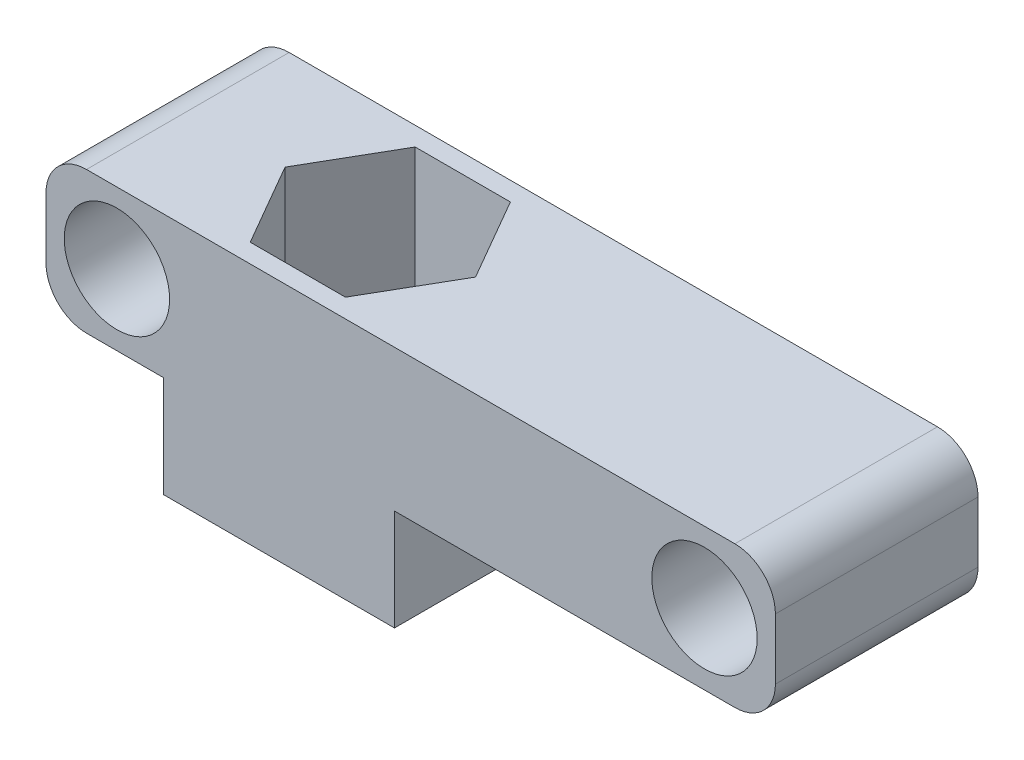
from build123d import *

# Parameters (mm, degrees)
CROQUIS1_W              = 36
CROQUIS1_H              = 7
CROQUIS1_R              = 2.6
SALIENTE_EXTRUIR1_DEPTH = 10
CORTAR_EXTRUIR1_DEPTH   = 7
CROQUIS4_W              = 11.4
CROQUIS4_H              = 10
SALIENTE_EXTRUIR2_DEPTH = 5
REDONDEO1_R             = 2


with BuildPart() as part:
    # Croquis1 → Saliente-Extruir1 (new body)
    with BuildSketch(Plane.XY):
        with Locations((-28.016694491, 12.37804878)):
            Rectangle(CROQUIS1_W, CROQUIS1_H)
        with Locations((-42.516694491, 12.37804878)):
            Circle(CROQUIS1_R, mode=Mode.SUBTRACT)
        with Locations((-13.516694491, 12.37804878)):
            Circle(CROQUIS1_R, mode=Mode.SUBTRACT)
    extrude(amount=SALIENTE_EXTRUIR1_DEPTH)

    # Croquis2 → Cortar-Extruir1 (cut)
    with BuildSketch(Plane.XZ.offset(-8.87804878)):
        Polygon((-29.816694491, 5), (-32.166694491, 9.070319398), (-36.866694491, 9.070319398), (-39.216694491, 5), (-36.866694491, 0.929680602), (-32.166694491, 0.929680602), align=None)
    extrude(amount=-CORTAR_EXTRUIR1_DEPTH, mode=Mode.SUBTRACT)

    # Croquis4 → Saliente-Extruir2 (add)
    with BuildSketch(Plane.XZ.offset(-8.87804878)):
        with Locations((-34.516694491, 5)):
            Rectangle(CROQUIS4_W, CROQUIS4_H)
        Polygon((-29.816694491, 5), (-32.166694491, 9.070319398), (-36.866694491, 9.070319398), (-39.216694491, 5), (-36.866694491, 0.929680602), (-32.166694491, 0.929680602), align=None, mode=Mode.SUBTRACT)
    extrude(amount=SALIENTE_EXTRUIR2_DEPTH)

    # Redondeo1
    redondeo1_edges = [part.edges().sort_by_distance(p)[0] for p in [
        (-10.016694491, 15.87804878, 5),
        (-10.016694491, 8.87804878, 5),
        (-46.016694491, 8.87804878, 5),
        (-46.016694491, 15.87804878, 5),
    ]]
    fillet(redondeo1_edges, radius=REDONDEO1_R)


solid = part.part
